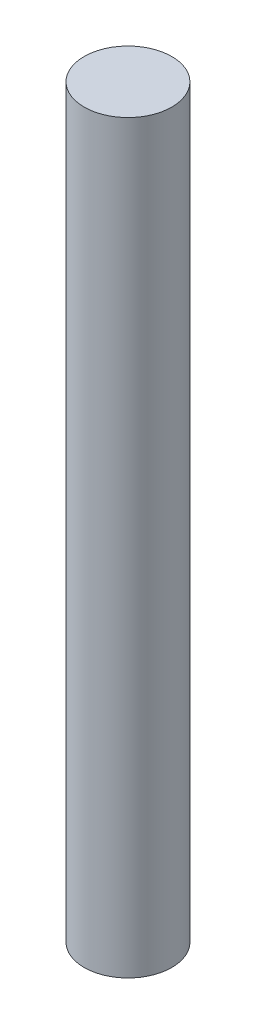
from build123d import *

# Parameters (mm, degrees)
SKETCH2_R           = 5
BOSS_EXTRUDE1_DEPTH = 85


with BuildPart() as part:
    # Sketch2 → Boss-Extrude1 (new body)
    with BuildSketch(Plane(origin=(0, 0, 0), x_dir=(1, 0, 0), z_dir=(0, 1, 0))):
        with Locations(Location((0, 0, 0), (0, 0, 270))):
            Circle(SKETCH2_R)
    extrude(amount=BOSS_EXTRUDE1_DEPTH)


solid = part.part
